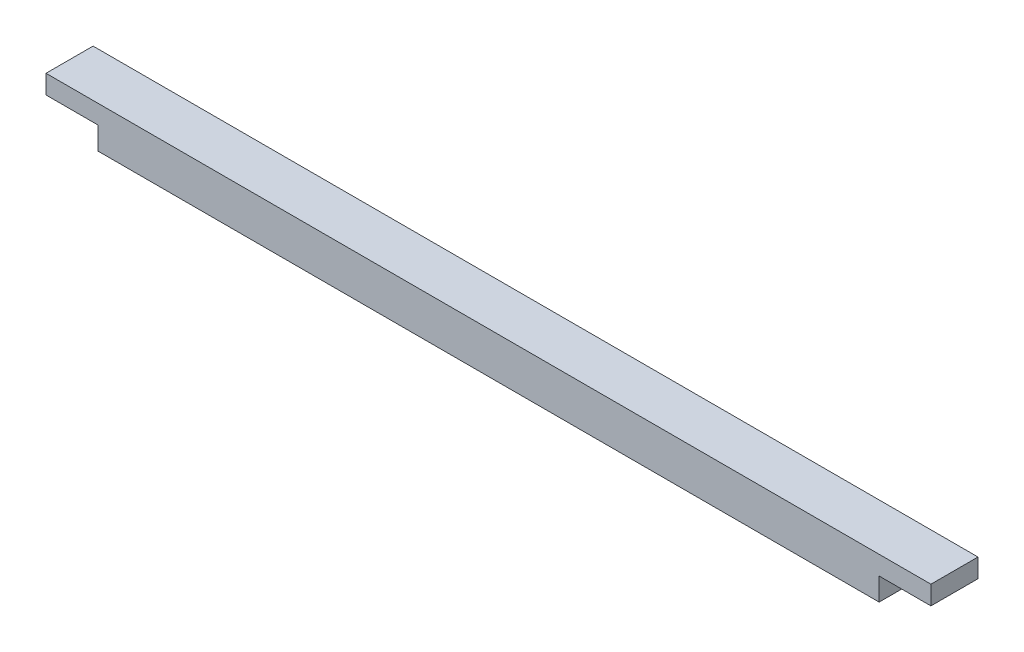
from build123d import *

# Parameters (mm, degrees)
SKETCH_1_W          = 470
SKETCH_1_H          = 25
EXTRUDE_1_DEPTH     = 22
SKETCH_2_W          = 27.5
SKETCH_2_H          = 12
CUT_EXTRUDE_1_DEPTH = 472.178310197
SKETCH_3_W          = 27.5
SKETCH_3_H          = 12
CUT_EXTRUDE_2_DEPTH = 472.178310197


with BuildPart() as part:
    # Эскиз1 → Бобышка-Вытянуть1 (new body)
    with BuildSketch(Plane(origin=(0, 0, 0), x_dir=(1, 0, 0), z_dir=(0, 1, 0))):
        with Locations((235, 12.5)):
            Rectangle(SKETCH_1_W, SKETCH_1_H)
    extrude(amount=EXTRUDE_1_DEPTH)

    # Эскиз2 → Вырез-Вытянуть1 (cut, through all)
    with BuildSketch(Plane.XY):
        with Locations((456.25, 6)):
            Rectangle(SKETCH_2_W, SKETCH_2_H)
    extrude(amount=-CUT_EXTRUDE_1_DEPTH, mode=Mode.SUBTRACT)

    # Эскиз3 → Вырез-Вытянуть2 (cut, through all)
    with BuildSketch(Plane.XY):
        with Locations((13.75, 6)):
            Rectangle(SKETCH_3_W, SKETCH_3_H)
    extrude(amount=-CUT_EXTRUDE_2_DEPTH, mode=Mode.SUBTRACT)


solid = part.part
